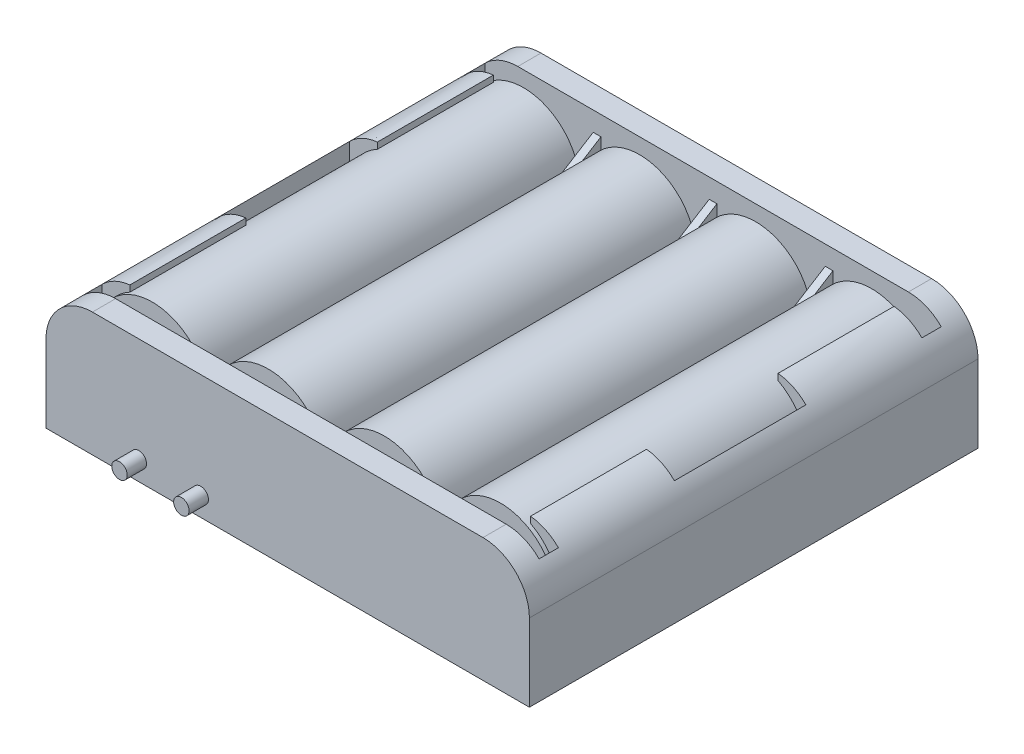
from build123d import *

# Parameters (mm, degrees)
SKETCH1_W           = 62.5
SKETCH1_H           = 58
BOSS_EXTRUDE1_DEPTH = 16
FILLET1_R           = 6
SKETCH2_W           = 14
SKETCH2_H           = 52
CUT_EXTRUDE1_DEPTH  = 14
CUT_EXTRUDE2_REACH  = 59.294
SKETCH4_R           = 7.25
BOSS_EXTRUDE3_DEPTH = 24
SKETCH6_R           = 1
BOSS_EXTRUDE5_DEPTH = 2.5


with BuildPart() as part:
    # Sketch1 → Boss-Extrude1 (new body)
    with BuildSketch(Plane(origin=(0, 0, 0), x_dir=(1, 0, 0), z_dir=(0, 1, 0))):
        Rectangle(SKETCH1_W, SKETCH1_H)
    extrude(amount=BOSS_EXTRUDE1_DEPTH)

    # Fillet1
    fillet1_edges = [part.edges().sort_by_distance(p)[0] for p in [
        (-31.25, 16, 0),
        (31.25, 16, 0),
    ]]
    fillet(fillet1_edges, radius=FILLET1_R)

    # Sketch2 → Cut-Extrude1 (cut)
    with BuildSketch(Plane(origin=(0, 16, 0), x_dir=(1, 0, 0), z_dir=(0, 1, 0))):
        Polygon((-29.5, 26), (-15.5, 26), (-15.5, -26), (-29.5, -26), (-29.5, -23.5), (-25.9, -23.5), (-25.9, -8.5), (-29.5, -8.5), (-29.5, 8.5), (-25.9, 8.5), (-25.9, 23.5), (-29.5, 23.5), align=None)
        with Locations((-7.5, 0)):
            Rectangle(SKETCH2_W, SKETCH2_H)
        Polygon((15.5, 26), (29.5, 26), (29.5, 23.5), (25.9, 23.5), (25.9, 8.5), (29.5, 8.5), (29.5, -8.5), (25.9, -8.5), (25.9, -23.5), (29.5, -23.5), (29.5, -26), (15.5, -26), align=None)
        with Locations((7.5, 0)):
            Rectangle(SKETCH2_W, SKETCH2_H)
    extrude(amount=-CUT_EXTRUDE1_DEPTH, mode=Mode.SUBTRACT)

    # Cut-Extrude2: up to this face of the body (flat: up to its plane)
    cut_extrude2_end = Plane(part.part.faces().sort_by_distance((-15.5, 9, 0))[0])
    # Sketch3 → Cut-Extrude2 (cut, up to the picked face)
    with BuildSketch(Plane(origin=(15.5, 0, 0), x_dir=(0, 0, -1), z_dir=(1, 0, 0)), mode=Mode.PRIVATE) as cut_extrude2_sk1:
        Polygon((-26, 16), (-26, 13.5), (-17.5, 8.2), (17.5, 8.2), (26, 13.5), (26, 16), align=None)
    cut_extrude2_tool1 = split(extrude(cut_extrude2_sk1.sketch, amount=-CUT_EXTRUDE2_REACH, mode=Mode.PRIVATE), bisect_by=cut_extrude2_end, keep=Keep.BOTH, mode=Mode.PRIVATE)
    add(cut_extrude2_tool1.solids().sort_by(Axis((15.5, 12.366556, 0), (-1, 0, 0)))[0], mode=Mode.SUBTRACT)

    # Sketch4 → Boss-Extrude3 (add, symmetric)
    with BuildSketch(Plane.XY):
        with Locations((-22.5, 8.75)):
            Circle(SKETCH4_R)
        with Locations((-7.5, 8.75)):
            Circle(SKETCH4_R)
        with Locations((22.5, 8.75)):
            Circle(SKETCH4_R)
        with Locations((7.5, 8.75)):
            Circle(SKETCH4_R)
    extrude(amount=BOSS_EXTRUDE3_DEPTH, both=True)

    # Sketch6 → Boss-Extrude5 (add)
    with BuildSketch(Plane.XY.offset(29)):
        with Locations(Location((-19.25, 2.5, 0), (0, 0, 180))):
            Circle(SKETCH6_R)
        with Locations(Location((-11.25, 2.5, 0), (0, 0, 180))):
            Circle(SKETCH6_R)
    extrude(amount=BOSS_EXTRUDE5_DEPTH)


solid = part.part
